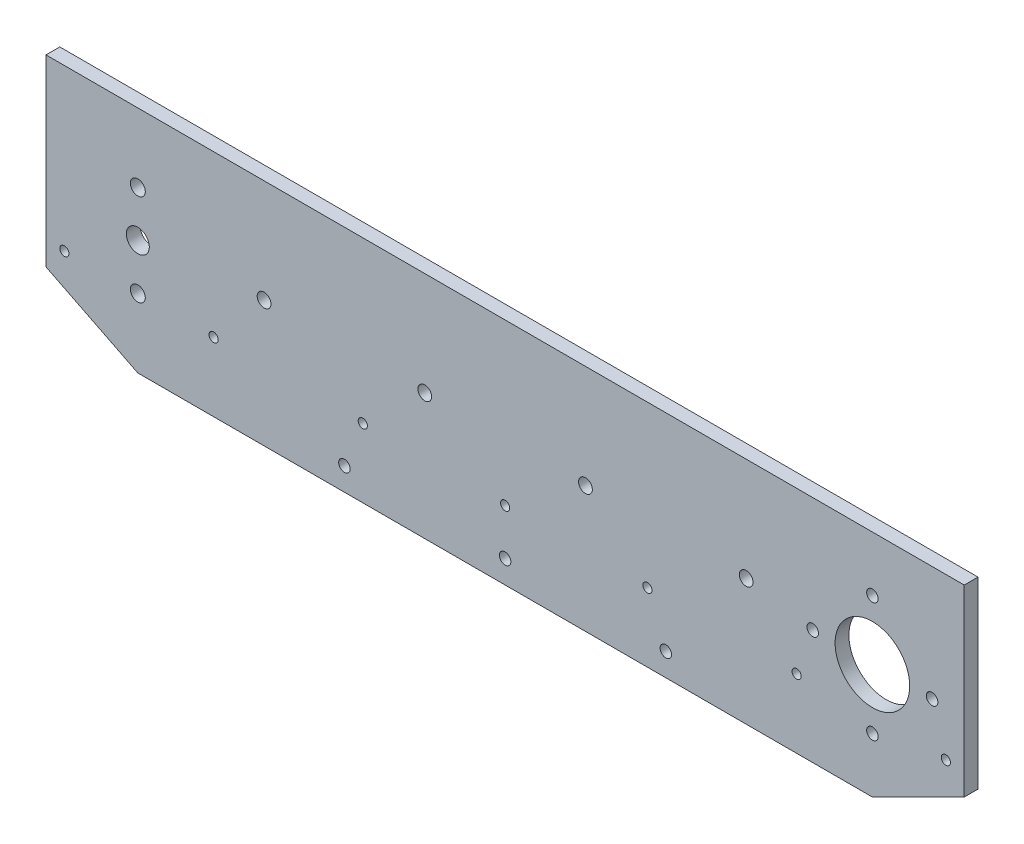
from build123d import *

# Parameters (mm, degrees)
SKETCH_1_W          = 400
SKETCH_1_H          = 100
EXTRUDE_1_DEPTH     = 6
SKETCH_2_R          = 5
SKETCH_2_R_2        = 3.25
SKETCH_2_R_3        = 16.25
SKETCH_2_R_4        = 2.5
CUT_EXTRUDE_2_DEPTH = 207.242575624
SKETCH_3_R          = 3
SKETCH_3_R_2        = 2
SKETCH_3_R_3        = 2.5
CUT_EXTRUDE_3_DEPTH = 207.242575624


with BuildPart() as part:
    # 草圖1 → 伸長1 (new body)
    with BuildSketch(Plane.XY):
        Rectangle(SKETCH_1_W, SKETCH_1_H)
    extrude(amount=EXTRUDE_1_DEPTH)

    # 草圖2 → 伸長2 (cut, through all)
    with BuildSketch(Plane.XY.offset(6)):
        with Locations((-160, 0)):
            Circle(SKETCH_2_R)
        with Locations((-160, 20)):
            Circle(SKETCH_2_R_2)
        with Locations((-160, -20)):
            Circle(SKETCH_2_R_2)
        with Locations((160, 0)):
            Circle(SKETCH_2_R_3)
        with Locations((160, 26)):
            Circle(SKETCH_2_R_4)
        with Locations((134, 0)):
            Circle(SKETCH_2_R_4)
        with Locations((186, 0)):
            Circle(SKETCH_2_R_4)
        with Locations((160, -26)):
            Circle(SKETCH_2_R_4)
        Polygon((-200, -30), (-160, -50), (-200, -50), align=None)
        Polygon((200, -50), (200, -30), (160, -50), align=None)
    extrude(amount=-CUT_EXTRUDE_2_DEPTH, mode=Mode.SUBTRACT)

    # 草圖3 → 伸長3 (cut, through all)
    with BuildSketch(Plane.XY.offset(6)):
        with Locations((-105, 5)):
            Circle(SKETCH_3_R)
        with Locations((-35, 5)):
            Circle(SKETCH_3_R)
        with Locations((35, 5)):
            Circle(SKETCH_3_R)
        with Locations((105, 5)):
            Circle(SKETCH_3_R)
        with Locations((-62, -20)):
            Circle(SKETCH_3_R_2)
        with Locations((0, -20)):
            Circle(SKETCH_3_R_2)
        with Locations((62, -20)):
            Circle(SKETCH_3_R_2)
        with Locations((-192, -20)):
            Circle(SKETCH_3_R_2)
        with Locations((127, -20)):
            Circle(SKETCH_3_R_2)
        with Locations((-127, -20)):
            Circle(SKETCH_3_R_2)
        with Locations((192, -20)):
            Circle(SKETCH_3_R_2)
        with Locations((-70, -40)):
            Circle(SKETCH_3_R_3)
        with Locations((0, -40)):
            Circle(SKETCH_3_R_3)
        with Locations((70, -40)):
            Circle(SKETCH_3_R_3)
    extrude(amount=-CUT_EXTRUDE_3_DEPTH, mode=Mode.SUBTRACT)


solid = part.part
